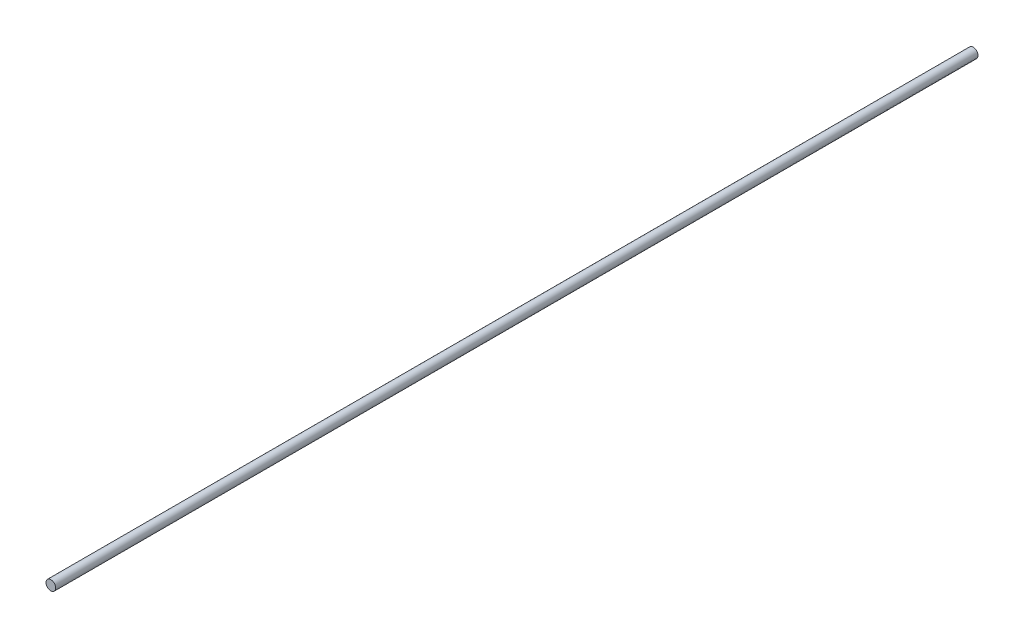
from build123d import *

# Parameters (mm, degrees)
ESQUISSE1_R        = 1
BOSS_EXTRU_1_DEPTH = 190


with BuildPart() as part:
    # Esquisse1 → Boss.-Extru.1 (new body)
    with BuildSketch(Plane.XY):
        Circle(ESQUISSE1_R)
    extrude(amount=BOSS_EXTRU_1_DEPTH)


solid = part.part
